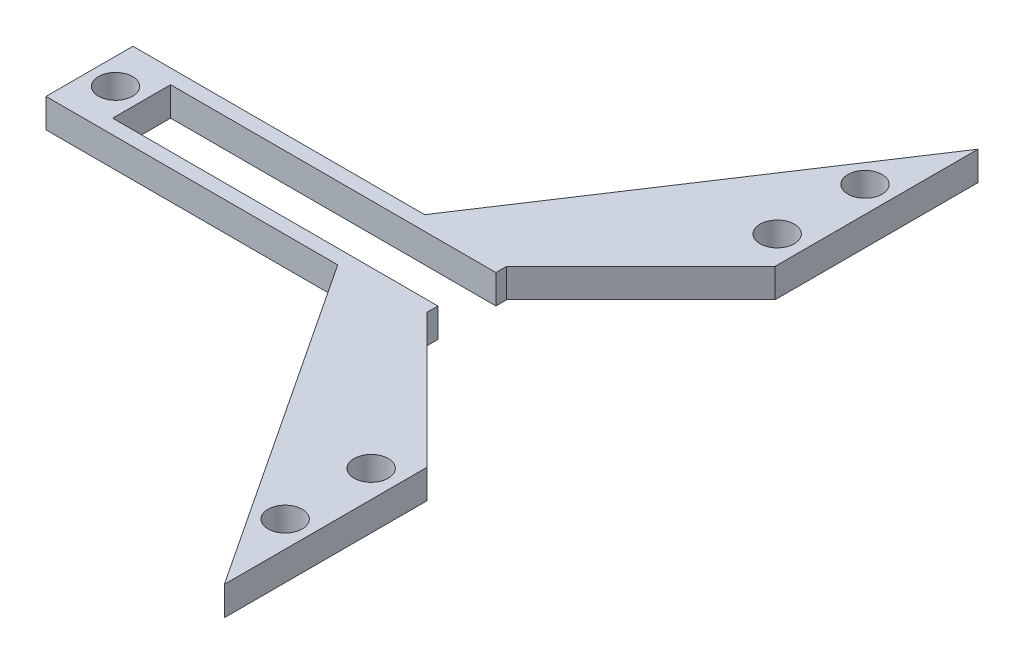
from build123d import *

# Parameters (mm, degrees)
BOSS_EXTRUDE2_DEPTH = 2.54
SKETCH7_R           = 1.4986
SKETCH7_W           = 25.4
SKETCH7_H           = 5.08
CUT_EXTRUDE1_DEPTH  = 2.54
CUT_EXTRUDE2_DEPTH  = 47.522645815


with BuildPart() as part:
    # Sketch1 → Boss-Extrude2 (new body)
    with BuildSketch(Plane(origin=(0, 0, 0), x_dir=(1, 0, 0), z_dir=(0, 1, 0))):
        Polygon((3.221868426, 6.029765094), (14.988277627, 17.796174295), (14.988277627, 35.576174295), (-4.295819053, 6.35), (-29.8704, 6.35), (-29.8704, -1.27), (-4.295819053, -1.27), (14.988277627, -30.496174295), (14.988277627, -12.716174295), (3.221868426, -0.949765094), align=None)
    extrude(amount=BOSS_EXTRUDE2_DEPTH)

    # Sketch7 → Cut-Extrude1 (cut)
    with BuildSketch(Plane(origin=(0, 2.54, 0), x_dir=(1, 0, 0), z_dir=(0, 1, 0))):
        with Locations(Location((-27.5844, 2.54, 0), (0, 0, 270))):
            Circle(SKETCH7_R)
        with Locations(Location((12.702277627, 27.956174295, 0), (0, 0, 270))):
            Circle(SKETCH7_R)
        with Locations(Location((12.622030753, 20.33659685, 0), (0, 0, 270))):
            Circle(SKETCH7_R)
        with Locations(Location((12.622030753, -15.25659685, 0), (0, 0, 90))):
            Circle(SKETCH7_R)
        with Locations(Location((12.702277627, -22.876174295, 0), (0, 0, 90))):
            Circle(SKETCH7_R)
        with Locations((-12.5984, 2.54)):
            Rectangle(SKETCH7_W, SKETCH7_H)
    extrude(amount=-CUT_EXTRUDE1_DEPTH, mode=Mode.SUBTRACT)

    # Sketch8 → Cut-Extrude2 (cut, through all)
    with BuildSketch(Plane(origin=(0, 2.54, 0), x_dir=(1, 0, 0), z_dir=(0, 1, 0))):
        Polygon((0.1016, 5.08), (3.221868426, 5.08), (3.221868426, 0), (0, 0), align=None)
    extrude(amount=-CUT_EXTRUDE2_DEPTH, mode=Mode.SUBTRACT)


solid = part.part
